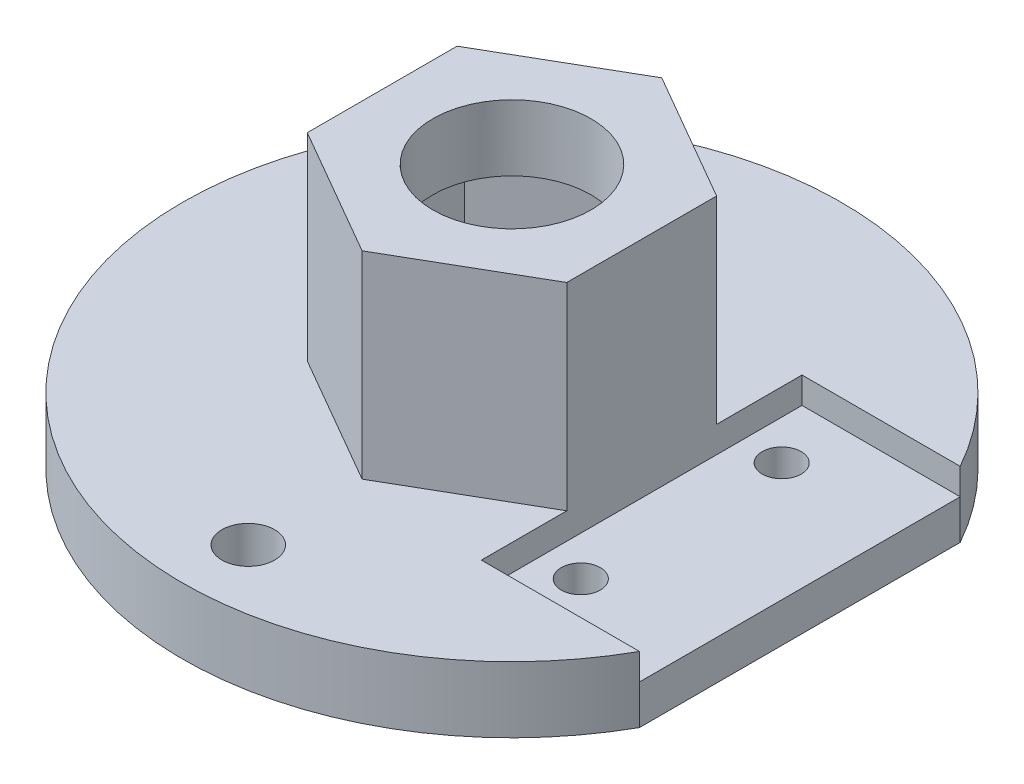
from build123d import *
from build123d.topology import SkipClean

# Parameters (mm, degrees)
SKETCH_1_R           = 25
SKETCH_1_R_2         = 2
SKETCH_1_R_3         = 15
EXTRUDE_1_DEPTH      = 5
EXTRUDE_START        = -5
EXTRUDE_2_DEPTH      = 5
CUT_EXTRUDE_START    = -5
SKETCH_3_R           = 1.48
CUT_EXTRUDE_1_DEPTH  = 5
SKETCH_4_W           = 8.547618338
SKETCH_4_H           = 20.32
SKETCH_4_R           = 1.48
SKETCH_4_R_2         = 1.532611102
EXTRUDE_3_DEPTH      = 25
SKETCH_5_R           = 1.48
EXTRUDE_4_DEPTH      = 15
SKETCH_6_W           = 8.547618338
SKETCH_6_H           = 20.32
CUT_EXTRUDE_2_DEPTH  = 10
CUT_EXTRUDE_START_2  = -15
SKETCH_7_R           = 1.48
SKETCH_7_R_2         = 1.532611102
CUT_EXTRUDE_3_DEPTH  = 15
EXTRUDE_5_DEPTH      = 15
SKETCH_9_W           = 8.547618338
SKETCH_9_H           = 20.32
CUT_EXTRUDE_4_DEPTH  = 20
SKETCH_10_W          = 8.54761834
SKETCH_10_H          = 20.32
EXTRUDE_6_DEPTH      = 10
EXTRUDE_7_DEPTH      = 5
CUT_EXTRUDE_5_DEPTH  = 30
SKETCH_13_R          = 15
SKETCH_13_R_2        = 6.5
EXTRUDE_8_DEPTH      = 5
SKETCH_14_R          = 1.48
CUT_EXTRUDE_6_DEPTH  = 5
SKETCH_15_W          = 14.772216158
SKETCH_15_H          = 22.255287634
CUT_EXTRUDE_7_DEPTH  = 15
SKETCH_16_R          = 6.5
SKETCH_16_R_2        = 6
EXTRUDE_9_DEPTH      = 5
CUT_EXTRUDE_START_3  = -2
SKETCH_17_W          = 6.857896117
SKETCH_17_H          = 20.32
SKETCH_17_R          = 1.48
CUT_EXTRUDE_8_DEPTH  = 2
CUT_EXTRUDE_9_DEPTH  = 2
SKETCH_19_W          = 12
SKETCH_19_H          = 24.323680916
CUT_EXTRUDE_10_DEPTH = 2
EXTRUDE_START_2      = -3
SKETCH_20_R          = 2
EXTRUDE_10_DEPTH     = 3
SKETCH_21_R          = 1.48
CUT_EXTRUDE_11_DEPTH = 3
SKETCH_22_W          = 10.536991634
SKETCH_22_H          = 24.323680916
CUT_EXTRUDE_12_DEPTH = 3
SKETCH_23_R          = 9.842381662
SKETCH_23_R_2        = 6
EXTRUDE_11_DEPTH     = 15
CUT_EXTRUDE_13_DEPTH = 15
EXTRUDE_START_3      = -15
SKETCH_25_R          = 6
EXTRUDE_12_DEPTH     = 15
CUT_EXTRUDE_14_DEPTH = 15


with BuildPart() as part:
    # 草图1 → 凸台-拉伸1 (new body)
    with BuildSketch(Plane(origin=(0, 0, 0), x_dir=(1, 0, 0), z_dir=(0, 1, 0))):
        with Locations(Location((0, 0, 0), (0, 0, 270))):
            Circle(SKETCH_1_R)
        with Locations(Location((-17.320508076, 10, 0), (0, 0, 270))):
            Circle(SKETCH_1_R_2, mode=Mode.SUBTRACT)
        with Locations(Location((17.320508076, 10, 0), (0, 0, 270))):
            Circle(SKETCH_1_R_2, mode=Mode.SUBTRACT)
        with Locations(Location((0, -20, 0), (0, 0, 270))):
            Circle(SKETCH_1_R_2, mode=Mode.SUBTRACT)
        with Locations(Location((0, 0, 0), (0, 0, 270))):
            Circle(SKETCH_1_R_3, mode=Mode.SUBTRACT)
    extrude(amount=EXTRUDE_1_DEPTH)

    # 草图2 → 凸台-拉伸2 (add)
    with BuildSketch(Plane(origin=(0, 5, 0), x_dir=(1, 0, 0), z_dir=(0, 1, 0)).offset(EXTRUDE_START)):
        with BuildLine():
            Line((-22.842381662, 10.16), (-31.39, 10.16))
            Line((-31.39, 10.16), (-31.39, -10.16))
            Line((-31.39, -10.16), (-22.842381662, -10.16))
            ThreePointArc((-22.842381662, -10.16), (-23.266520659, -9.147076932), (-23.645768039, -8.116505025))
            ThreePointArc((-23.645768039, -8.116505025), (-26.455891038, -8.05087419), (-24.158684413, -6.431016049))
            ThreePointArc((-24.158684413, -6.431016049), (-25, 0), (-24.158684413, 6.431016049))
            ThreePointArc((-24.158684413, 6.431016049), (-26.455891038, 8.05087419), (-23.645768039, 8.116505025))
            ThreePointArc((-23.645768039, 8.116505025), (-23.266520659, 9.147076932), (-22.842381662, 10.16))
        make_face()
        with BuildLine():
            Line((-22.842381662, -10.16), (-22.842381662, 10.16))
            ThreePointArc((-22.842381662, 10.16), (-23.266520659, 9.147076932), (-23.645768039, 8.116505025))
            ThreePointArc((-23.645768039, 8.116505025), (-23.581599626, 7.871929254), (-23.56, 7.62))
            ThreePointArc((-23.56, 7.62), (-23.718117428, 6.954397667), (-24.158684413, 6.431016049))
            ThreePointArc((-24.158684413, 6.431016049), (-25, 0), (-24.158684413, -6.431016049))
            ThreePointArc((-24.158684413, -6.431016049), (-23.718117428, -6.954397667), (-23.56, -7.62))
            ThreePointArc((-23.56, -7.62), (-23.581599626, -7.871929254), (-23.645768039, -8.116505025))
            ThreePointArc((-23.645768039, -8.116505025), (-23.266520659, -9.147076932), (-22.842381662, -10.16))
        make_face()
    extrude(amount=EXTRUDE_2_DEPTH)

    # 草图3 → 切除-拉伸1 (cut)
    with BuildSketch(Plane(origin=(0, 5, 0), x_dir=(1, 0, 0), z_dir=(0, 1, 0)).offset(CUT_EXTRUDE_START)):
        with Locations(Location((-25.04, 7.62, 0), (0, 0, 270))):
            Circle(SKETCH_3_R)
        with Locations(Location((-25.04, -7.62, 0), (0, 0, 270))):
            Circle(SKETCH_3_R)
    extrude(amount=CUT_EXTRUDE_1_DEPTH, mode=Mode.SUBTRACT)

    # 草图4 → 凸台-拉伸3 (add)
    with SkipClean():  # the faces are left unmerged after this step: merging them gives an invalid solid
        with BuildSketch(Plane(origin=(0, 5, 0), x_dir=(1, 0, 0), z_dir=(0, 1, 0))):
            with Locations((-27.116190831, 0)):
                Rectangle(SKETCH_4_W, SKETCH_4_H)
            with Locations(Location((-25.04, 7.62, 0), (0, 0, 270))):
                Circle(SKETCH_4_R, mode=Mode.SUBTRACT)
            with Locations(Location((-25.04, -7.62, 0), (0, 0, 270))):
                Circle(SKETCH_4_R_2, mode=Mode.SUBTRACT)
        extrude(amount=EXTRUDE_3_DEPTH)

    # 草图5 → 凸台-拉伸4 (add)
    with BuildSketch(Plane.XZ):
        with Locations(Location((-25.04, 7.62, 0), (0, 0, 270))):
            Circle(SKETCH_5_R)
        with Locations(Location((-25.04, -7.62, 0), (0, 0, 90))):
            Circle(SKETCH_5_R)
    extrude(amount=-EXTRUDE_4_DEPTH)

    # 草图6 → 切除-拉伸2 (cut)
    with BuildSketch(Plane(origin=(0, 30, 0), x_dir=(1, 0, 0), z_dir=(0, 1, 0))):
        with Locations((-27.116190831, 0)):
            Rectangle(SKETCH_6_W, SKETCH_6_H)
    extrude(amount=-CUT_EXTRUDE_2_DEPTH, mode=Mode.SUBTRACT)

    # 草图7 → 切除-拉伸3 (cut)
    with BuildSketch(Plane(origin=(0, 20, 0), x_dir=(1, 0, 0), z_dir=(0, 1, 0)).offset(CUT_EXTRUDE_START_2)):
        with Locations(Location((-25.04, 7.62, 0), (0, 0, 270))):
            Circle(SKETCH_7_R)
        with Locations(Location((-25.04, -7.62, 0), (0, 0, 270))):
            Circle(SKETCH_7_R_2)
    extrude(amount=CUT_EXTRUDE_3_DEPTH, mode=Mode.SUBTRACT)

    # 草图8 → 凸台-拉伸5 (add)
    with BuildSketch(Plane(origin=(0, 5, 0), x_dir=(1, 0, 0), z_dir=(0, 1, 0))):
        with BuildLine():
            Line((31.390000002, 10.16), (22.842381662, 10.16))
            ThreePointArc((22.842381662, 10.16), (23.266520659, 9.147076932), (23.645768039, 8.116505025))
            ThreePointArc((23.645768039, 8.116505025), (25.291929254, 9.078400374), (26.52, 7.62))
            ThreePointArc((26.52, 7.62), (25.705602333, 6.298117428), (24.158684413, 6.431016049))
            ThreePointArc((24.158684413, 6.431016049), (25, 0), (24.158684413, -6.431016049))
            ThreePointArc((24.158684413, -6.431016049), (25.705602333, -6.298117428), (26.52, -7.62))
            ThreePointArc((26.52, -7.62), (25.291929254, -9.078400374), (23.645768039, -8.116505025))
            ThreePointArc((23.645768039, -8.116505025), (23.266520659, -9.147076932), (22.842381662, -10.16))
            Line((22.842381662, -10.16), (31.390000002, -10.16))
            Line((31.390000002, -10.16), (31.390000002, 10.16))
        make_face()
        with BuildLine():
            ThreePointArc((23.645768039, 8.116505025), (23.266520659, 9.147076932), (22.842381662, 10.16))
            Line((22.842381662, 10.16), (22.842381662, -10.16))
            ThreePointArc((22.842381662, -10.16), (23.266520659, -9.147076932), (23.645768039, -8.116505025))
            ThreePointArc((23.645768039, -8.116505025), (23.624108962, -7.18912581), (24.158684413, -6.431016049))
            ThreePointArc((24.158684413, -6.431016049), (25, 0), (24.158684413, 6.431016049))
            ThreePointArc((24.158684413, 6.431016049), (23.624108962, 7.18912581), (23.645768039, 8.116505025))
        make_face()
    extrude(amount=EXTRUDE_5_DEPTH)

    # 草图9 → 切除-拉伸4 (cut)
    with BuildSketch(Plane(origin=(0, 20, 0), x_dir=(1, 0, 0), z_dir=(0, 1, 0))):
        with Locations((-27.116190831, 0)):
            Rectangle(SKETCH_9_W, SKETCH_9_H)
    extrude(amount=-CUT_EXTRUDE_4_DEPTH, mode=Mode.SUBTRACT)

    # 草图10 → 凸台-拉伸6 (add)
    with BuildSketch(Plane.XZ):
        with Locations((27.116190832, 0)):
            Rectangle(SKETCH_10_W, SKETCH_10_H)
    extrude(amount=-EXTRUDE_6_DEPTH)

    # 草图11 → 凸台-拉伸7 (add)
    with BuildSketch(Plane(origin=(0, 5, 0), x_dir=(1, 0, 0), z_dir=(0, 1, 0)).offset(EXTRUDE_START)):
        with BuildLine():
            Line((-22.842381662, -10.16), (-22.842381662, 10.16))
            ThreePointArc((-22.842381662, 10.16), (-25, 0), (-22.842381662, -10.16))
        make_face()
    extrude(amount=EXTRUDE_7_DEPTH)

    # 草图12 → 切除-拉伸5 (cut)
    with BuildSketch(Plane.XZ):
        with BuildLine():
            ThreePointArc((29.700277779, 10.16), (30.964688111, 5.149775752), (31.390000002, 0))
            Line((31.390000002, 0), (31.390000002, 10.16))
            Line((31.390000002, 10.16), (29.700277779, 10.16))
        make_face()
        with BuildLine():
            ThreePointArc((31.390000002, 0), (30.964688111, -5.149775752), (29.700277779, -10.16))
            Line((29.700277779, -10.16), (31.390000002, -10.16))
            Line((31.390000002, -10.16), (31.390000002, 0))
        make_face()
    extrude(amount=-CUT_EXTRUDE_5_DEPTH, mode=Mode.SUBTRACT)

    # 草图13 → 凸台-拉伸8 (add)
    with BuildSketch(Plane.XZ):
        Circle(SKETCH_13_R)
        with Locations(Location((0, 0, 0), (0, 0, 270))):
            Circle(SKETCH_13_R_2, mode=Mode.SUBTRACT)
    extrude(amount=-EXTRUDE_8_DEPTH)

    # 草图14 → 切除-拉伸6 (cut)
    with BuildSketch(Plane(origin=(0, 5, 0), x_dir=(1, 0, 0), z_dir=(0, 1, 0)).offset(CUT_EXTRUDE_START)):
        with Locations(Location((25.04, 7.62, 0), (0, 0, 270))):
            Circle(SKETCH_14_R)
        with Locations(Location((25.04, -7.62, 0), (0, 0, 270))):
            Circle(SKETCH_14_R)
    extrude(amount=CUT_EXTRUDE_6_DEPTH, mode=Mode.SUBTRACT)

    # 草图15 → 切除-拉伸7 (cut)
    with BuildSketch(Plane(origin=(0, 20, 0), x_dir=(1, 0, 0), z_dir=(0, 1, 0))):
        with Locations((30.228489741, -0.967643817)):
            Rectangle(SKETCH_15_W, SKETCH_15_H)
    extrude(amount=-CUT_EXTRUDE_7_DEPTH, mode=Mode.SUBTRACT)

    # 草图16 → 凸台-拉伸9 (add)
    with BuildSketch(Plane(origin=(0, 5, 0), x_dir=(1, 0, 0), z_dir=(0, 1, 0)).offset(EXTRUDE_START)):
        Circle(SKETCH_16_R)
        with Locations(Location((0, 0, 0), (0, 0, 270))):
            Circle(SKETCH_16_R_2, mode=Mode.SUBTRACT)
    extrude(amount=EXTRUDE_9_DEPTH)

    # 草图17 → 切除-拉伸8 (cut)
    # profile 1 of 3: a face of its own
    with BuildSketch(Plane(origin=(0, 5, 0), x_dir=(1, 0, 0), z_dir=(0, 1, 0)).offset(CUT_EXTRUDE_START_3)):
        with Locations((26.27132972, 0)):
            Rectangle(SKETCH_17_W, SKETCH_17_H)
        with Locations(Location((25.04, 7.62, 0), (0, 0, 270))):
            Circle(SKETCH_17_R, mode=Mode.SUBTRACT)
        with Locations(Location((25.04, -7.62, 0), (0, 0, 270))):
            Circle(SKETCH_17_R, mode=Mode.SUBTRACT)
    # profile 2 of 3: a face of its own
    with BuildSketch(Plane(origin=(0, 5, 0), x_dir=(1, 0, 0), z_dir=(0, 1, 0)).offset(CUT_EXTRUDE_START_3)):
        with BuildLine():
            Line((33.817210561, 10.16), (33.817210561, -10.16))
            Line((33.817210561, -10.16), (29.700277779, -10.16))
            ThreePointArc((29.700277779, -10.16), (31.390000002, 0), (29.700277779, 10.16))
            Line((29.700277779, 10.16), (33.817210561, 10.16))
        make_face()
    # profile 3 of 3: a face of its own
    with BuildSketch(Plane(origin=(0, 5, 0), x_dir=(1, 0, 0), z_dir=(0, 1, 0)).offset(CUT_EXTRUDE_START_3)):
        with BuildLine():
            Line((29.700277779, -10.16), (29.700277779, 10.16))
            ThreePointArc((29.700277779, 10.16), (31.390000002, 0), (29.700277779, -10.16))
        make_face()
    extrude(amount=CUT_EXTRUDE_8_DEPTH, mode=Mode.SUBTRACT)

    # 草图18 → 切除-拉伸9 (cut)
    with BuildSketch(Plane(origin=(0, 5, 0), x_dir=(1, 0, 0), z_dir=(0, 1, 0)).offset(CUT_EXTRUDE_START_3)):
        with BuildLine():
            Line((21.842381662, 0), (22.842381662, 0))
            Line((22.842381662, 0), (22.842381662, 10.16))
            ThreePointArc((22.842381662, 10.16), (22.364790624, 11.172114409), (21.842381662, 12.161840458))
            Line((21.842381662, 12.161840458), (21.842381662, 0))
        make_face()
        with BuildLine():
            Line((22.842381662, -10.16), (22.842381662, 0))
            Line((22.842381662, 0), (21.842381662, 0))
            Line((21.842381662, 0), (21.842381662, -12.161840458))
            ThreePointArc((21.842381662, -12.161840458), (22.364790624, -11.172114409), (22.842381662, -10.16))
        make_face()
    extrude(amount=CUT_EXTRUDE_9_DEPTH, mode=Mode.SUBTRACT)

    # 草图19 → 切除-拉伸10 (cut)
    with BuildSketch(Plane(origin=(0, 5, 0), x_dir=(1, 0, 0), z_dir=(0, 1, 0))):
        with Locations((15.842381662, 0)):
            Rectangle(SKETCH_19_W, SKETCH_19_H)
    extrude(amount=-CUT_EXTRUDE_10_DEPTH, mode=Mode.SUBTRACT)

    # 草图20 → 凸台-拉伸10 (add)
    with BuildSketch(Plane(origin=(0, 3, 0), x_dir=(1, 0, 0), z_dir=(0, 1, 0)).offset(EXTRUDE_START_2)):
        with Locations((17.320508076, 10)):
            Circle(SKETCH_20_R)
    extrude(amount=EXTRUDE_10_DEPTH)

    # 草图21 → 切除-拉伸11 (cut)
    with BuildSketch(Plane(origin=(0, 3, 0), x_dir=(1, 0, 0), z_dir=(0, 1, 0))):
        with Locations(Location((12.842381662, 7.62, 0), (0, 0, 270))):
            Circle(SKETCH_21_R)
        with Locations(Location((12.842381662, -7.62, 0), (0, 0, 270))):
            Circle(SKETCH_21_R)
    extrude(amount=-CUT_EXTRUDE_11_DEPTH, mode=Mode.SUBTRACT)

    # 草图22 → 切除-拉伸12 (cut)
    with BuildSketch(Plane(origin=(0, 3, 0), x_dir=(1, 0, 0), z_dir=(0, 1, 0))):
        with Locations((27.110877479, 0)):
            Rectangle(SKETCH_22_W, SKETCH_22_H)
    extrude(amount=-CUT_EXTRUDE_12_DEPTH, mode=Mode.SUBTRACT)

    # 草图23 → 凸台-拉伸11 (add)
    with BuildSketch(Plane(origin=(0, 5, 0), x_dir=(1, 0, 0), z_dir=(0, 1, 0))):
        Circle(SKETCH_23_R)
        with Locations(Location((0, 0, 0), (0, 0, 270))):
            Circle(SKETCH_23_R_2, mode=Mode.SUBTRACT)
    extrude(amount=EXTRUDE_11_DEPTH)

    # 草图24 → 切除-拉伸13 (cut)
    with BuildSketch(Plane.XZ):
        Polygon((8.5, 4.907477288), (0, 9.814954576), (-8.5, 4.907477288), (-8.5, -4.907477288), (0, -9.814954576), (8.5, -4.907477288), align=None)
    extrude(amount=-CUT_EXTRUDE_13_DEPTH, mode=Mode.SUBTRACT)

    # 草图25 → 凸台-拉伸12 (add)
    with BuildSketch(Plane(origin=(0, 20, 0), x_dir=(1, 0, 0), z_dir=(0, 1, 0)).offset(EXTRUDE_START_3)):
        Polygon((9.842381662, 5.682501702), (0, 11.365003404), (-9.842381662, 5.682501702), (-9.842381662, -5.682501702), (0, -11.365003404), (9.842381662, -5.682501702), align=None)
        with Locations(Location((0, 0, 0), (0, 0, 270))):
            Circle(SKETCH_25_R, mode=Mode.SUBTRACT)
    extrude(amount=EXTRUDE_12_DEPTH)

    # 草图27 → 切除-拉伸14 (cut)
    with BuildSketch(Plane.XZ):
        Polygon((0, 9.814954576), (-8.5, 4.907477288), (-8.5, -4.907477288), (0, -9.814954576), (8.5, -4.907477288), (8.5, 4.907477288), align=None)
    extrude(amount=-CUT_EXTRUDE_14_DEPTH, mode=Mode.SUBTRACT)


solid = part.part
